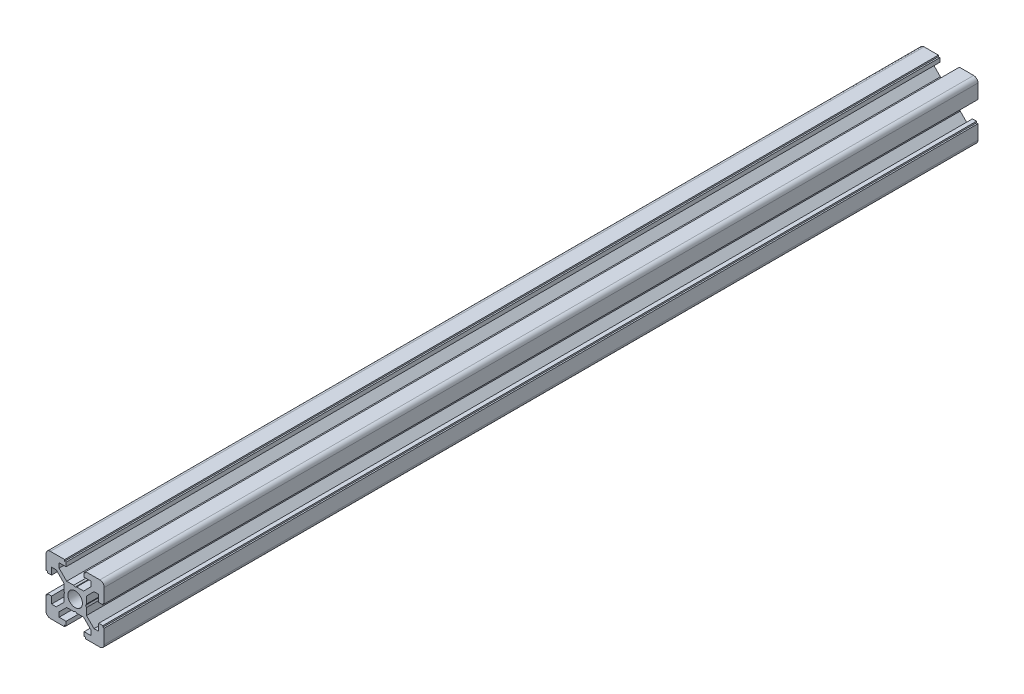
from build123d import *

# Parameters (mm, degrees)
SKETCH_28_R     = 2.5
EXTRUDE_1_DEPTH = 300


with BuildPart() as part:
    # 草图28 → 凸台-拉伸1 (new body)
    with BuildSketch(Plane.XY):
        with BuildLine():
            Line((-3.9, -0.519615242), (-3.9, -2.910050506))
            Line((-3.9, -2.910050506), (-6.489949494, -5.5))
            Line((-6.489949494, -5.5), (-8.1, -5.5))
            Line((-8.1, -5.5), (-8.1, -3.1))
            Line((-8.1, -3.1), (-9.5, -3.1))
            Line((-9.5, -3.1), (-9.5, -3.6))
            Line((-9.5, -3.6), (-10, -3.6))
            Line((-10, -3.6), (-10, -8.5))
            ThreePointArc((-10, -8.5), (-9.560660172, -9.560660172), (-8.5, -10))
            Line((-8.5, -10), (-3.6, -10))
            Line((-3.6, -10), (-3.6, -9.5))
            Line((-3.6, -9.5), (-3.1, -9.5))
            Line((-3.1, -9.5), (-3.1, -8.1))
            Line((-3.1, -8.1), (-5.5, -8.1))
            Line((-5.5, -8.1), (-5.5, -6.489949494))
            Line((-5.5, -6.489949494), (-2.910050506, -3.9))
            Line((-2.910050506, -3.9), (-0.519615242, -3.9))
            Line((-0.519615242, -3.9), (0, -3.6))
            Line((0, -3.6), (0.519615242, -3.9))
            Line((0.519615242, -3.9), (2.910050506, -3.9))
            Line((2.910050506, -3.9), (5.5, -6.489949494))
            Line((5.5, -6.489949494), (5.5, -8.1))
            Line((5.5, -8.1), (3.1, -8.1))
            Line((3.1, -8.1), (3.1, -9.5))
            Line((3.1, -9.5), (3.6, -9.5))
            Line((3.6, -9.5), (3.6, -10))
            Line((3.6, -10), (8.5, -10))
            ThreePointArc((8.5, -10), (9.560660172, -9.560660172), (10, -8.5))
            Line((10, -8.5), (10, -3.6))
            Line((10, -3.6), (9.5, -3.6))
            Line((9.5, -3.6), (9.5, -3.1))
            Line((9.5, -3.1), (8.1, -3.1))
            Line((8.1, -3.1), (8.1, -5.5))
            Line((8.1, -5.5), (6.489949494, -5.5))
            Line((6.489949494, -5.5), (3.9, -2.910050506))
            Line((3.9, -2.910050506), (3.9, -0.519615242))
            Line((3.9, -0.519615242), (3.6, 0))
            Line((3.6, 0), (3.9, 0.519615242))
            Line((3.9, 0.519615242), (3.9, 2.910050506))
            Line((3.9, 2.910050506), (6.489949494, 5.5))
            Line((6.489949494, 5.5), (8.1, 5.5))
            Line((8.1, 5.5), (8.1, 3.1))
            Line((8.1, 3.1), (9.5, 3.1))
            Line((9.5, 3.1), (9.5, 3.6))
            Line((9.5, 3.6), (10, 3.6))
            Line((10, 3.6), (10, 8.5))
            ThreePointArc((10, 8.5), (9.560660172, 9.560660172), (8.5, 10))
            Line((8.5, 10), (3.6, 10))
            Line((3.6, 10), (3.6, 9.5))
            Line((3.6, 9.5), (3.1, 9.5))
            Line((3.1, 9.5), (3.1, 8.1))
            Line((3.1, 8.1), (5.5, 8.1))
            Line((5.5, 8.1), (5.5, 6.489949494))
            Line((5.5, 6.489949494), (2.910050506, 3.9))
            Line((2.910050506, 3.9), (0.519615242, 3.9))
            Line((0.519615242, 3.9), (0, 3.6))
            Line((0, 3.6), (-0.519615242, 3.9))
            Line((-0.519615242, 3.9), (-2.910050506, 3.9))
            Line((-2.910050506, 3.9), (-5.5, 6.489949494))
            Line((-5.5, 6.489949494), (-5.5, 8.1))
            Line((-5.5, 8.1), (-3.1, 8.1))
            Line((-3.1, 8.1), (-3.1, 9.5))
            Line((-3.1, 9.5), (-3.6, 9.5))
            Line((-3.6, 9.5), (-3.6, 10))
            Line((-3.6, 10), (-8.5, 10))
            ThreePointArc((-8.5, 10), (-9.560660172, 9.560660172), (-10, 8.5))
            Line((-10, 8.5), (-10, 3.6))
            Line((-10, 3.6), (-9.5, 3.6))
            Line((-9.5, 3.6), (-9.5, 3.1))
            Line((-9.5, 3.1), (-8.1, 3.1))
            Line((-8.1, 3.1), (-8.1, 5.5))
            Line((-8.1, 5.5), (-6.489949494, 5.5))
            Line((-6.489949494, 5.5), (-3.9, 2.910050506))
            Line((-3.9, 2.910050506), (-3.9, 0.519615242))
            Line((-3.9, 0.519615242), (-3.6, 0))
            Line((-3.6, 0), (-3.9, -0.519615242))
        make_face()
        Circle(SKETCH_28_R, mode=Mode.SUBTRACT)
    extrude(amount=EXTRUDE_1_DEPTH)


solid = part.part
